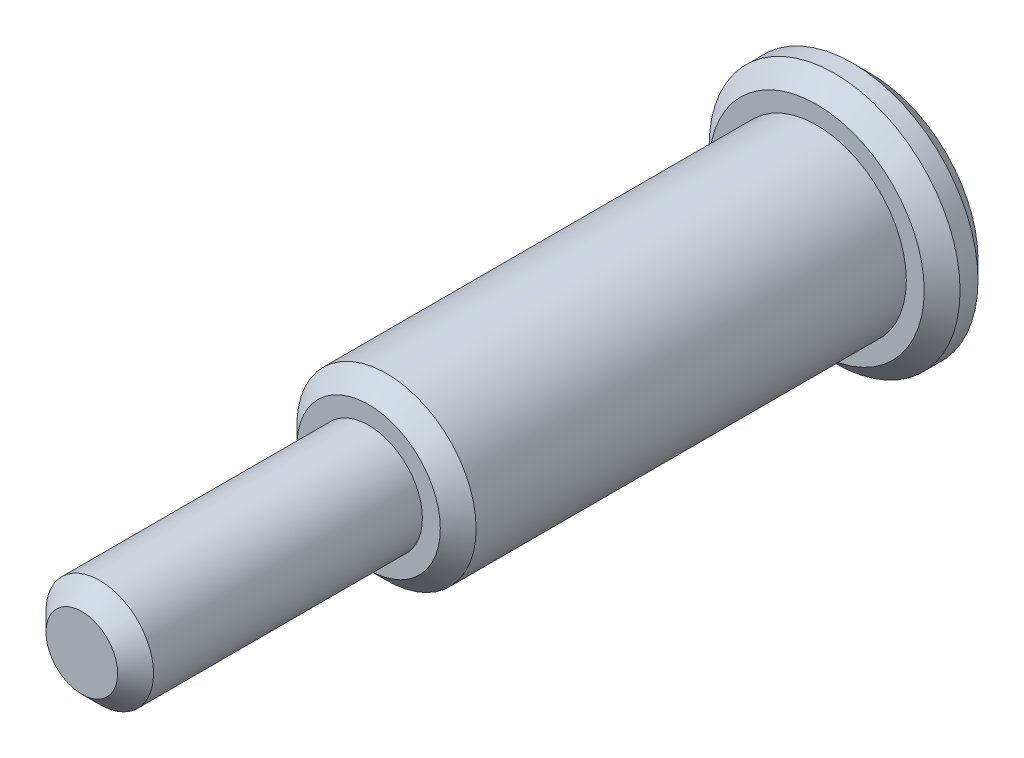
from build123d import *

# Parameters (mm, degrees)
CHAMFER1_SIZE = 1


with BuildPart() as part:
    # Sketch1 → Revolve1 (revolve)
    with BuildSketch(Plane(origin=(0, 0, 0), x_dir=(1, 0, 0), z_dir=(0, 1, 0))):
        Polygon((0, 0), (7, 0), (7, -3), (5, -3), (5, -28), (3, -28), (3, -44), (0, -44), align=None)
    revolve(axis=Axis((0, 0, 44), (0, 0, -1)))

    # Chamfer1
    chamfer1_edges = [part.edges().sort_by_distance(p)[0] for p in [
        (-3, 0, 44),
        (-5, 0, 28),
        (-7, 0, 3),
        (-7, 0, 0),
    ]]
    chamfer(chamfer1_edges, length=CHAMFER1_SIZE)


solid = part.part
